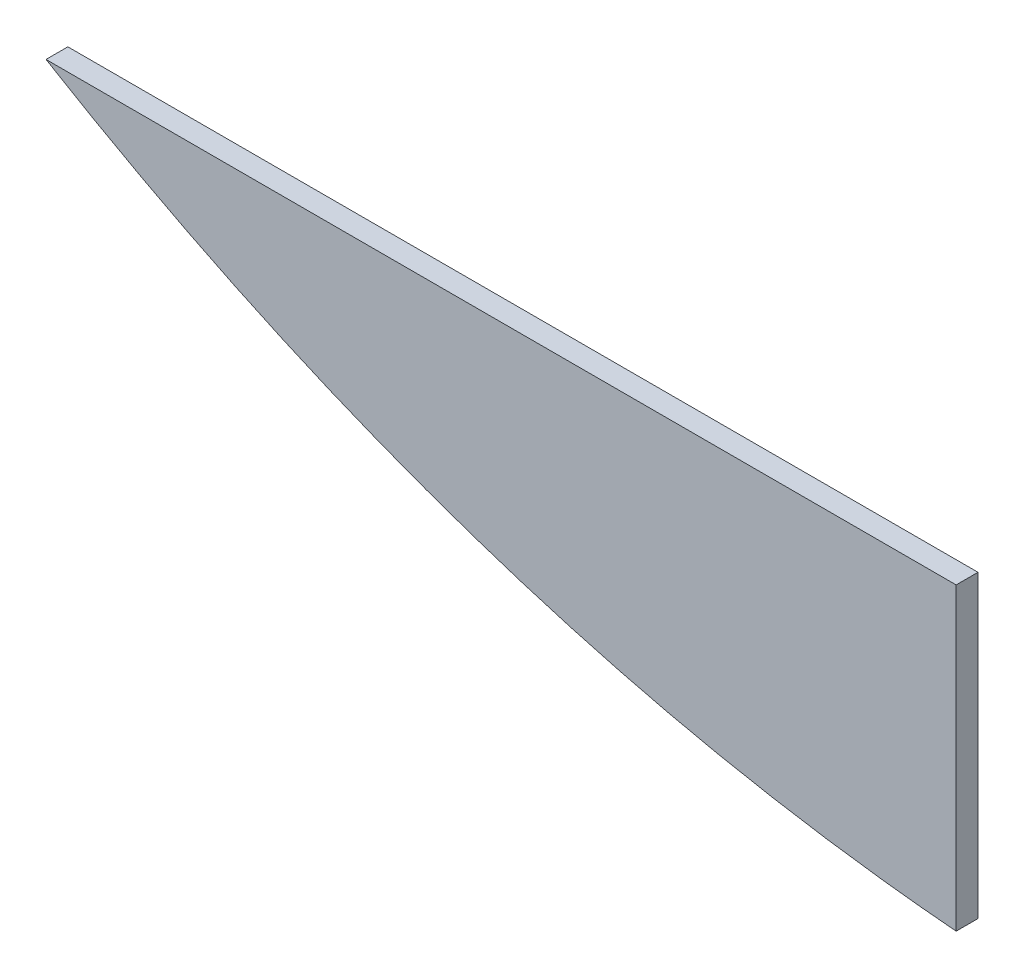
from build123d import *

# Parameters (mm, degrees)
BOSS_EXTRUDE1_DEPTH = 3.175


with BuildPart() as part:
    # Sketch1 → Boss-Extrude1 (new body)
    with BuildSketch(Plane.XY):
        with BuildLine():
            Line((66.113147042, -21.78513299), (66.113147042, 21.78513299))
            Line((66.113147042, 21.78513299), (-66.113147042, 21.78513299))
            add(Edge.make_bspline(
                [(-66.113147042, 21.78513299), (-24.202910043, -3.340235665), (19.872521318, -17.863657658), (66.113147042, -21.78513299)],
                knots=[0, 0, 0, 0, 1, 1, 1, 1], degree=3))
        make_face()
    extrude(amount=BOSS_EXTRUDE1_DEPTH)


solid = part.part
